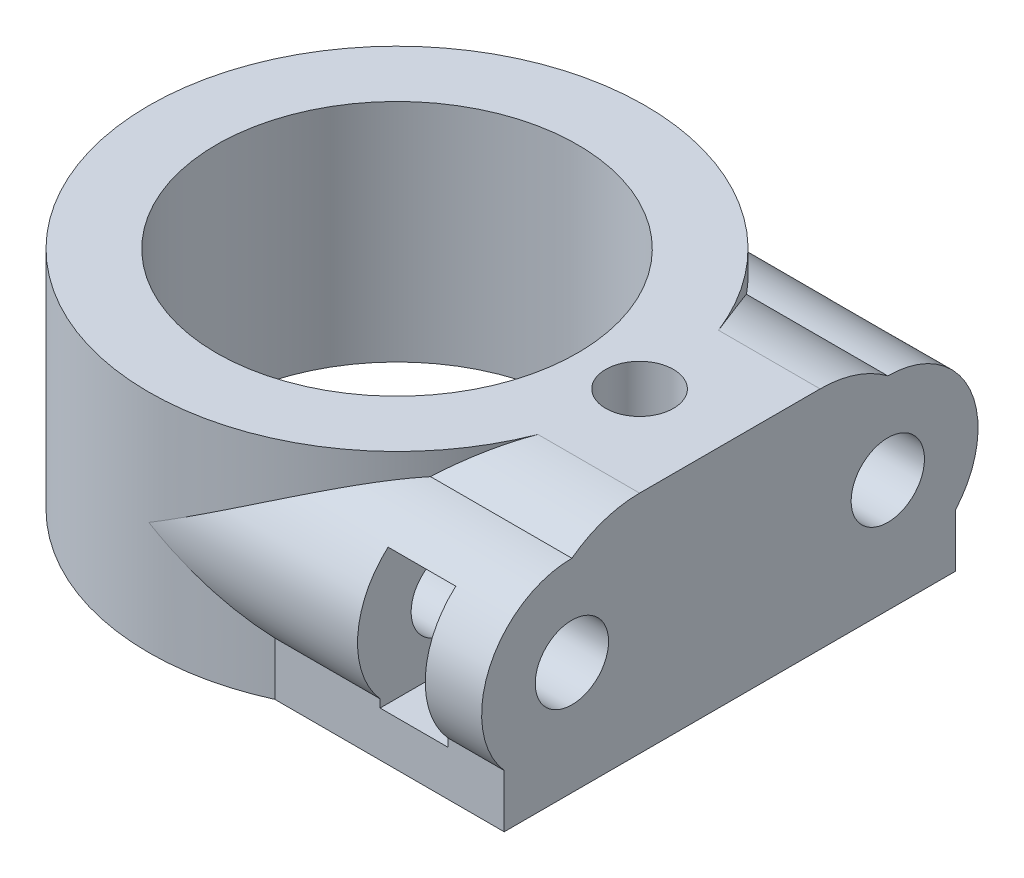
from build123d import *

# Parameters (mm, degrees)
SKETCH2_R                = 11
SKETCH2_R_2              = 8
BOSS_EXTRUDE1_DEPTH      = 10
BOSS_EXTRUDE2_REACH      = 31.733
BOSS_EXTRUDE2_END_RADIUS = 11
SKETCH6_R                = 1.5
CUT_EXTRUDE1_DEPTH       = 21.94188404
CUT_EXTRUDE2_DEPTH       = 3
SKETCH13_R               = 1.625
CUT_EXTRUDE3_DEPTH       = 10


with BuildPart() as part:
    # Sketch2 → Boss-Extrude1 (new body)
    with BuildSketch(Plane(origin=(0, 0, 0), x_dir=(1, 0, 0), z_dir=(0, 1, 0))):
        with Locations(Location((0, 0, 0), (0, 0, 270))):
            Circle(SKETCH2_R)
        with Locations(Location((0, 0, 0), (0, 0, 270))):
            Circle(SKETCH2_R_2, mode=Mode.SUBTRACT)
    extrude(amount=BOSS_EXTRUDE1_DEPTH)

    # Boss-Extrude2: up to this cylinder (the profile starts outside it)
    boss_extrude2_end = Plane(origin=(0, 4.771396, 0), z_dir=(0, -1, 0)) * Cylinder(BOSS_EXTRUDE2_END_RADIUS, 86.466, mode=Mode.PRIVATE)
    # Sketch4 → Boss-Extrude2 (add, up to the surface)
    with BuildSketch(Plane(origin=(14.75, 0, 0), x_dir=(0, 0, -1), z_dir=(1, 0, 0)), mode=Mode.PRIVATE) as boss_extrude2_sk1:
        with BuildLine():
            Line((4, 10), (-4, 10))
            ThreePointArc((-4, 10), (-5.58113883, 9.74341649), (-7, 9))
            ThreePointArc((-7, 9), (-10.645751311, 6.645751311), (-10, 2.354248689))
            Line((-10, 2.354248689), (-10, 0))
            Line((-10, 0), (10, 0))
            Line((10, 0), (10, 2.354248689))
            ThreePointArc((10, 2.354248689), (10.645751311, 6.645751311), (7, 9))
            ThreePointArc((7, 9), (5.58113883, 9.74341649), (4, 10))
        make_face()
    boss_extrude2_tool1 = extrude(boss_extrude2_sk1.sketch, amount=-BOSS_EXTRUDE2_REACH, mode=Mode.PRIVATE) - boss_extrude2_end
    add(boss_extrude2_tool1.solids().sort_by_distance((14.75, 4.771396, 0))[0])

    # Sketch6 → Cut-Extrude1 (cut, through all)
    with BuildSketch(Plane(origin=(0, 10, 0), x_dir=(1, 0, 0), z_dir=(0, 1, 0))):
        with Locations(Location((10.75, 0, 0), (0, 0, 270))):
            Circle(SKETCH6_R)
    extrude(amount=-CUT_EXTRUDE1_DEPTH, mode=Mode.SUBTRACT)

    # Sketch11 → Cut-Extrude2 (cut)
    with BuildSketch(Plane(origin=(12.25, 0, 0), x_dir=(0, 0, -1), z_dir=(1, 0, 0))):
        with BuildLine():
            Line((10, 2.354248689), (10, 2))
            Line((10, 2), (5.267949192, 2))
            Line((5.267949192, 2), (3.535898385, 5))
            Line((3.535898385, 5), (5.267949192, 8))
            Line((5.267949192, 8), (9.645751311, 8))
            ThreePointArc((9.645751311, 8), (10.992149037, 5.25049165), (10, 2.354248689))
        make_face()
        with BuildLine():
            Line((-3.535898385, 5), (-5.267949192, 2))
            Line((-5.267949192, 2), (-10, 2))
            Line((-10, 2), (-10, 2.354248689))
            ThreePointArc((-10, 2.354248689), (-10.992149037, 5.25049165), (-9.645751311, 8))
            Line((-9.645751311, 8), (-5.267949192, 8))
            Line((-5.267949192, 8), (-3.535898385, 5))
        make_face()
    extrude(amount=-CUT_EXTRUDE2_DEPTH, mode=Mode.SUBTRACT)

    # Sketch13 → Cut-Extrude3 (cut)
    with BuildSketch(Plane(origin=(14.75, 0, 0), x_dir=(0, 0, -1), z_dir=(1, 0, 0))):
        with Locations((-7, 5)):
            Circle(SKETCH13_R)
        with Locations((7, 5)):
            Circle(SKETCH13_R)
    extrude(amount=-CUT_EXTRUDE3_DEPTH, mode=Mode.SUBTRACT)


solid = part.part
